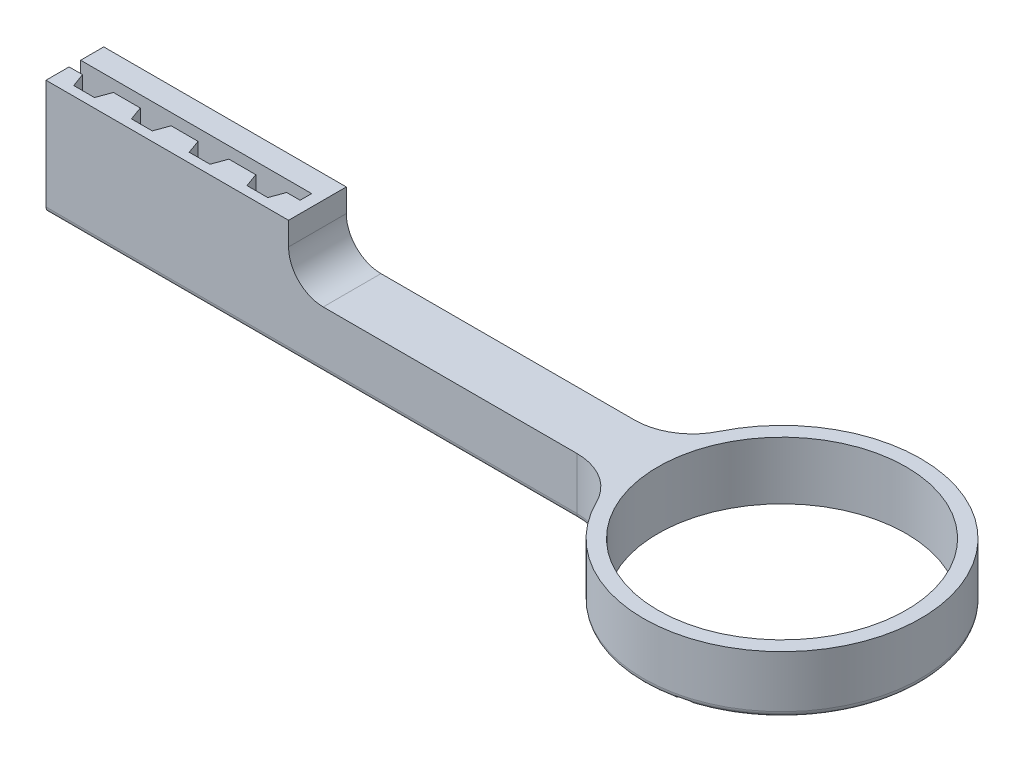
from build123d import *

# Parameters (mm, degrees)
SKETCH_1_R               = 12
SKETCH_1_R_2             = 10.75
RING_DEPTH               = 5
SKETCH_2_W               = 50
SKETCH_2_H               = 5
STICK_DEPTH              = 5
SKETCH_3_W               = 21
SKETCH_3_H               = 5
KEY_DEPTH                = 10
FILLET_1_R               = 5
FILLET_5_R               = 3
CUT_EXTRUDE_1_DEPTH      = 63.839058045
CUT_EXTRUDE_1_DEPTH_BACK = 63.839058045
FILLET_7_R               = 0.5


with BuildPart() as part:
    # Эскиз1 → ring (new body)
    with BuildSketch(Plane(origin=(0, 0, 0), x_dir=(1, 0, 0), z_dir=(0, 1, 0))):
        with Locations(Location((0, 0, 0), (0, 0, 270))):
            Circle(SKETCH_1_R)
        with Locations(Location((0, 0, 0), (0, 0, 270))):
            Circle(SKETCH_1_R_2, mode=Mode.SUBTRACT)
    extrude(amount=RING_DEPTH)

    # Эскиз2 → stick (add)
    with BuildSketch(Plane(origin=(0, 0, 0), x_dir=(1, 0, 0), z_dir=(0, 1, 0))):
        with Locations((-36.22497216, 0)):
            Rectangle(SKETCH_2_W, SKETCH_2_H)
    extrude(amount=STICK_DEPTH)

    # Эскиз3 → key (add)
    with BuildSketch(Plane(origin=(0, 0, 0), x_dir=(1, 0, 0), z_dir=(0, 1, 0))):
        with Locations((-50.72497216, 0)):
            Rectangle(SKETCH_3_W, SKETCH_3_H)
    extrude(amount=KEY_DEPTH)

    # Скругление1
    fillet_1_edges = [part.edges().sort_by_distance(p)[0] for p in [
        (-11.736694594, 2.5, 2.5),
        (-11.736694594, 2.5, -2.5),
    ]]
    fillet(fillet_1_edges, radius=FILLET_1_R)

    # Скругление5
    fillet_5_edges = [part.edges().sort_by_distance(p)[0] for p in [
        (-40.22497216, 5, 0),
    ]]
    fillet(fillet_5_edges, radius=FILLET_5_R)

    # Эскиз4 → Вытянуть1 (cut, two sides: drawn at the far end of the back side and taken through both)
    with BuildSketch(Plane(origin=(0, 2.5, 0), x_dir=(1, 0, 0), z_dir=(0, 1, 0)).offset(-CUT_EXTRUDE_1_DEPTH_BACK)):
        Polygon((-61.22497216, 0.5), (-41.22497216, 0.5), (-41.22497216, -0.5), (-42.388207879, -0.5), (-42.82497216, -1.7), (-44.62497216, -1.7), (-45.061736441, -0.5), (-46.22497216, -0.5), (-47.388207879, -0.5), (-47.82497216, -1.7), (-49.62497216, -1.7), (-50.061736441, -0.5), (-51.22497216, -0.5), (-52.388207879, -0.5), (-52.82497216, -1.7), (-54.62497216, -1.7), (-55.061736441, -0.5), (-56.22497216, -0.5), (-57.388207879, -0.5), (-57.82497216, -1.7), (-59.62497216, -1.7), (-60.061736441, -0.5), (-61.22497216, -0.5), align=None)
    extrude(amount=CUT_EXTRUDE_1_DEPTH + CUT_EXTRUDE_1_DEPTH_BACK, mode=Mode.SUBTRACT)

    # Скругление7
    fillet_7_edges = [part.edges().sort_by_distance(p)[0] for p in [
        (-38.240559231, 0, 2.5),
        (12, 0, 0),
        (-38.240559231, 0, -2.5),
        (-12.613175603, 0, 3.255626562),
        (-12.613175603, 0, -3.255626562),
    ]]
    fillet(fillet_7_edges, radius=FILLET_7_R)


solid = part.part
